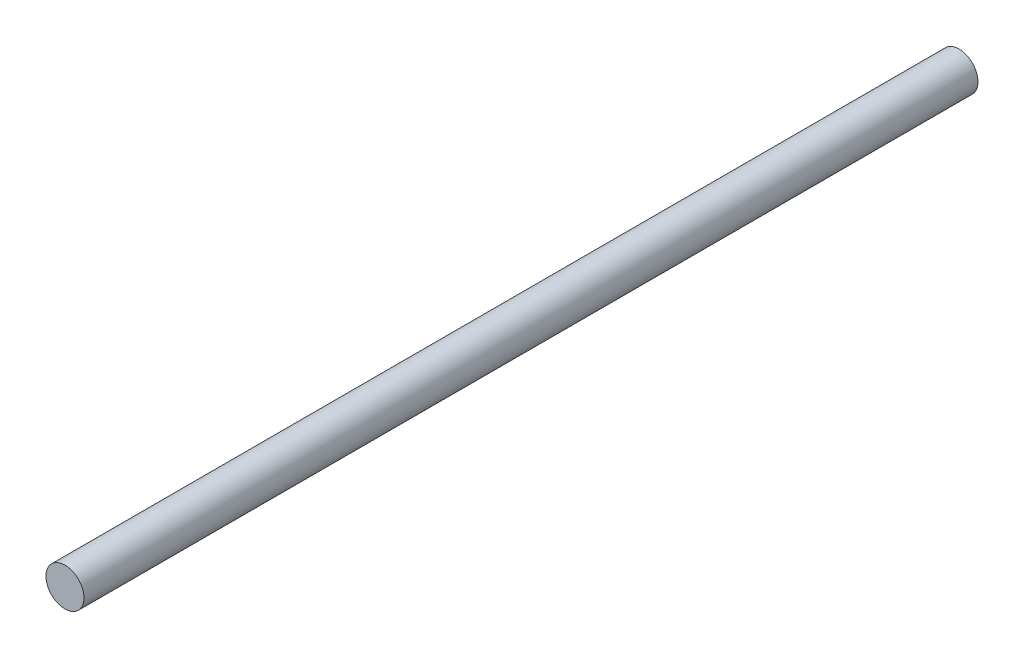
from build123d import *

# Parameters (mm, degrees)
SKETCH1_R           = 3.175
BOSS_EXTRUDE1_DEPTH = 149.352


with BuildPart() as part:
    # Sketch1 → Boss-Extrude1 (new body)
    with BuildSketch(Plane.XY):
        Circle(SKETCH1_R)
    extrude(amount=BOSS_EXTRUDE1_DEPTH)


solid = part.part
